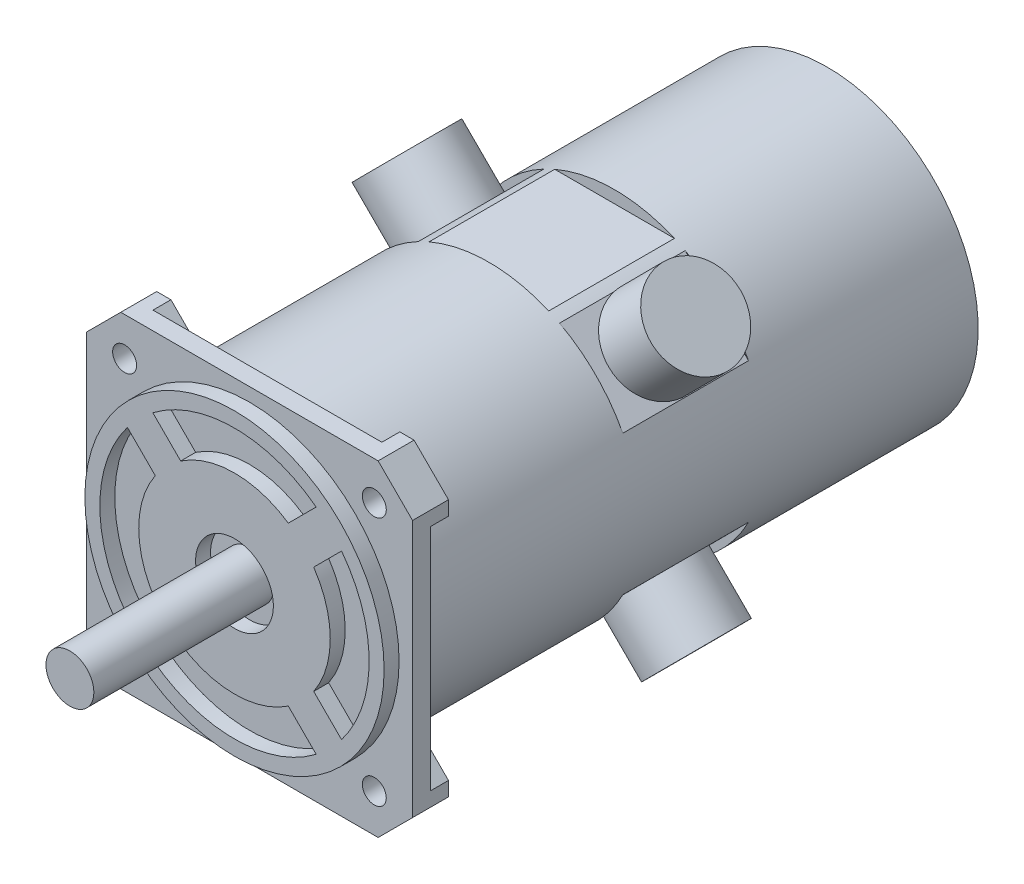
from build123d import *
from build123d.topology import SkipClean

# Parameters (mm, degrees)
SKETCH1_R           = 2
BOSS_EXTRUDE1_DEPTH = 6
SKETCH2_R           = 25
SKETCH2_R_2         = 6.5
BOSS_EXTRUDE2_DEPTH = 2.5
SKETCH1_3_R         = 4
BOSS_EXTRUDE3_DEPTH = 30
CUT_EXTRUDE1_DEPTH  = 3
BOSS_EXTRUDE4_START = 34
SKETCH5_R           = 25.25
BOSS_EXTRUDE4_DEPTH = 34
BOSS_EXTRUDE5_START = 21
BOSS_EXTRUDE5_DEPTH = 21
BOSS_EXTRUDE6_START = 35.5
SKETCH7_R           = 25.25
BOSS_EXTRUDE6_DEPTH = 35.5
SKETCH8_R           = 7.5
BOSS_EXTRUDE7_DEPTH = 10
CIRPATTERN1_COUNT   = 4


with BuildPart() as part:
    # Sketch1 → Boss-Extrude1 (new body)
    with BuildSketch(Plane.XY):
        Polygon((-21.5, 27.25), (21.5, 27.25), (27.25, 21.5), (27.25, -21.5), (21.5, -27.25), (-21.5, -27.25), (-27.25, -21.5), (-27.25, 21.5), align=None)
        with Locations((20.859650045, 20.859650045)):
            Circle(SKETCH1_R, mode=Mode.SUBTRACT)
        with Locations((-20.859650045, 20.859650045)):
            Circle(SKETCH1_R, mode=Mode.SUBTRACT)
        with Locations((-20.859650045, -20.859650045)):
            Circle(SKETCH1_R, mode=Mode.SUBTRACT)
        with Locations((20.859650045, -20.859650045)):
            Circle(SKETCH1_R, mode=Mode.SUBTRACT)
    extrude(amount=-BOSS_EXTRUDE1_DEPTH)

    # Sketch2 → Boss-Extrude2 (add)
    with BuildSketch(Plane.XY):
        Circle(SKETCH2_R)
        Circle(SKETCH2_R_2, mode=Mode.SUBTRACT)
        with BuildLine():
            Line((-17.889167375, 13.646526688), (-13.234375729, 8.991735042))
            ThreePointArc((-13.234375729, 8.991735042), (-16, 0), (-13.234375729, -8.991735042))
            Line((-13.234375729, -8.991735042), (-17.889167375, -13.646526688))
            ThreePointArc((-17.889167375, -13.646526688), (-22.5, 0), (-17.889167375, 13.646526688))
        make_face(mode=Mode.SUBTRACT)
        with BuildLine():
            Line((-13.646526688, 17.889167375), (-8.991735042, 13.234375729))
            ThreePointArc((-8.991735042, 13.234375729), (0, 16), (8.991735042, 13.234375729))
            Line((8.991735042, 13.234375729), (13.646526688, 17.889167375))
            ThreePointArc((13.646526688, 17.889167375), (0, 22.5), (-13.646526688, 17.889167375))
        make_face(mode=Mode.SUBTRACT)
        with BuildLine():
            Line((17.889167375, 13.646526688), (13.234375729, 8.991735042))
            ThreePointArc((13.234375729, 8.991735042), (16, 0), (13.234375729, -8.991735042))
            Line((13.234375729, -8.991735042), (17.889167375, -13.646526688))
            ThreePointArc((17.889167375, -13.646526688), (22.5, 0), (17.889167375, 13.646526688))
        make_face(mode=Mode.SUBTRACT)
        with BuildLine():
            Line((8.991735042, -13.234375729), (13.646526688, -17.889167375))
            ThreePointArc((13.646526688, -17.889167375), (0, -22.5), (-13.646526688, -17.889167375))
            Line((-13.646526688, -17.889167375), (-8.991735042, -13.234375729))
            ThreePointArc((-8.991735042, -13.234375729), (0, -16), (8.991735042, -13.234375729))
        make_face(mode=Mode.SUBTRACT)
    extrude(amount=BOSS_EXTRUDE2_DEPTH)

    # Sketch1<3> → Boss-Extrude3 (add)
    with BuildSketch(Plane.XY):
        Circle(SKETCH1_3_R)
    extrude(amount=BOSS_EXTRUDE3_DEPTH)

    # Sketch3 → Cut-Extrude1 (cut)
    with BuildSketch(Plane(origin=(0, 0, -6), x_dir=(-1, 0, 0), z_dir=(0, 0, -1))):
        with BuildLine():
            Line((19.118272016, 27.25), (13.319474659, 21.451202643))
            ThreePointArc((13.319474659, 21.451202643), (0, 25.25), (-13.319474659, 21.451202643))
            Line((-13.319474659, 21.451202643), (-19.118272016, 27.25))
            Line((-19.118272016, 27.25), (19.118272016, 27.25))
        make_face()
        with BuildLine():
            Line((27.25, 19.118272016), (21.451202643, 13.319474659))
            ThreePointArc((21.451202643, 13.319474659), (25.25, 0), (21.451202643, -13.319474659))
            Line((21.451202643, -13.319474659), (27.25, -19.118272016))
            Line((27.25, -19.118272016), (27.25, 19.118272016))
        make_face()
        with BuildLine():
            Line((-27.25, 19.118272016), (-21.451202643, 13.319474659))
            ThreePointArc((-21.451202643, 13.319474659), (-25.25, 0), (-21.451202643, -13.319474659))
            Line((-21.451202643, -13.319474659), (-27.25, -19.118272016))
            Line((-27.25, -19.118272016), (-27.25, 19.118272016))
        make_face()
        with BuildLine():
            Line((-19.118272016, -27.25), (-13.319474659, -21.451202643))
            ThreePointArc((-13.319474659, -21.451202643), (0, -25.25), (13.319474659, -21.451202643))
            Line((13.319474659, -21.451202643), (19.118272016, -27.25))
            Line((19.118272016, -27.25), (-19.118272016, -27.25))
        make_face()
    extrude(amount=-CUT_EXTRUDE1_DEPTH, mode=Mode.SUBTRACT)

    # Sketch5 → Boss-Extrude4 (add)
    with BuildSketch(Plane(origin=(0, 0, -6), x_dir=(-1, 0, 0), z_dir=(0, 0, -1)).offset(BOSS_EXTRUDE4_START)):
        Circle(SKETCH5_R)
    extrude(amount=-BOSS_EXTRUDE4_DEPTH)

    # Sketch6 → Boss-Extrude5 (add)
    with SkipClean():  # the faces are left unmerged after this step: merging them gives an invalid solid
        with BuildSketch(Plane(origin=(0, 0, -40), x_dir=(-1, 0, 0), z_dir=(0, 0, -1)).offset(BOSS_EXTRUDE5_START)):
            with BuildLine():
                Line((-10, 23.185394109), (10, 23.185394109))
                ThreePointArc((10, 23.185394109), (10.910387984, 22.77116453), (11.803656596, 22.321204962))
                Line((11.803656596, 22.321204962), (22.382531694, 11.686948915))
                ThreePointArc((22.382531694, 11.686948915), (25.25, 0), (22.382531694, -11.686948915))
                Line((22.382531694, -11.686948915), (11.803656596, -22.321204962))
                ThreePointArc((11.803656596, -22.321204962), (10.910387984, -22.77116453), (10, -23.185394109))
                Line((10, -23.185394109), (-10, -23.185394109))
                ThreePointArc((-10, -23.185394109), (-10.910387984, -22.77116453), (-11.803656596, -22.321204962))
                Line((-11.803656596, -22.321204962), (-22.382531694, -11.686948915))
                ThreePointArc((-22.382531694, -11.686948915), (-25.25, 0), (-22.382531694, 11.686948915))
                Line((-22.382531694, 11.686948915), (-11.803656596, 22.321204962))
                ThreePointArc((-11.803656596, 22.321204962), (-10.910387984, 22.77116453), (-10, 23.185394109))
            make_face()
        extrude(amount=-BOSS_EXTRUDE5_DEPTH)

    # Sketch7 → Boss-Extrude6 (add)
    with SkipClean():  # the faces are left unmerged after this step: merging them gives an invalid solid
        with BuildSketch(Plane(origin=(0, 0, -61), x_dir=(-1, 0, 0), z_dir=(0, 0, -1)).offset(BOSS_EXTRUDE6_START)):
            Circle(SKETCH7_R)
        extrude(amount=-BOSS_EXTRUDE6_DEPTH)

    # Sketch8 → Boss-Extrude7 (add)
    with SkipClean():  # the faces are left unmerged after this step: merging them gives an invalid solid
        with BuildSketch(Plane(origin=(-17.093094145, 17.004076939, 0), x_dir=(0.7052583398611622, 0.7089504031004409, 0), z_dir=(-0.7089504031004409, 0.7052583398611622, 0))):
            with Locations((0, 50.5)):
                Circle(SKETCH8_R)
        boss_extrude7 = extrude(amount=BOSS_EXTRUDE7_DEPTH)

    # CirPattern1: Boss-Extrude7 ×4 about axis
    with SkipClean():  # the faces are left unmerged after this step: merging them gives an invalid solid
        cirpattern1_axis = Axis((0, 0, -3), (0, 0, -1))
        for i in range(1, CIRPATTERN1_COUNT):
            add(boss_extrude7.rotate(cirpattern1_axis, i * 360 / CIRPATTERN1_COUNT))


solid = part.part
